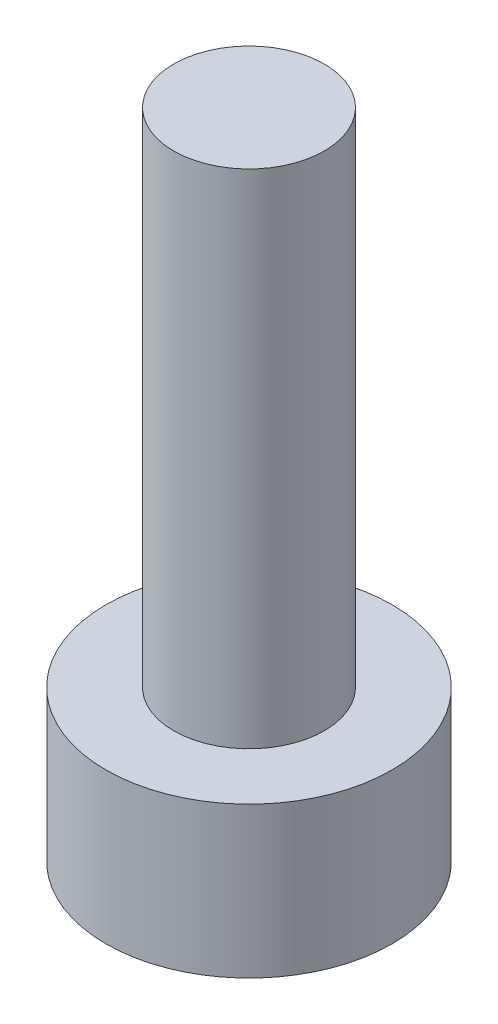
from build123d import *

# Parameters (mm, degrees)
CUT_EXTRUDE_1_DEPTH = 1.5


with BuildPart() as part:
    # 草图1 → 旋转1 (revolve)
    with BuildSketch(Plane.XY, mode=Mode.PRIVATE) as revolve_1_sk:
        Polygon((0, 0), (2.85, 0), (2.85, 3), (1.5, 3), (1.5, 13), (0, 13), align=None)
    revolve(revolve_1_sk.sketch.rotate(Axis((0, 5.079324982, 0), (0, -1, 0)), 90), axis=Axis((0, 5.079324982, 0), (0, -1, 0)))

    # 草图2 → 切除-拉伸1 (cut)
    with BuildSketch(Plane.XZ):
        Polygon((0, -1.425), (1.2340862, -0.7125), (1.2340862, 0.7125), (0, 1.425), (-1.2340862, 0.7125), (-1.2340862, -0.7125), align=None)
    extrude(amount=-CUT_EXTRUDE_1_DEPTH, mode=Mode.SUBTRACT)


solid = part.part
